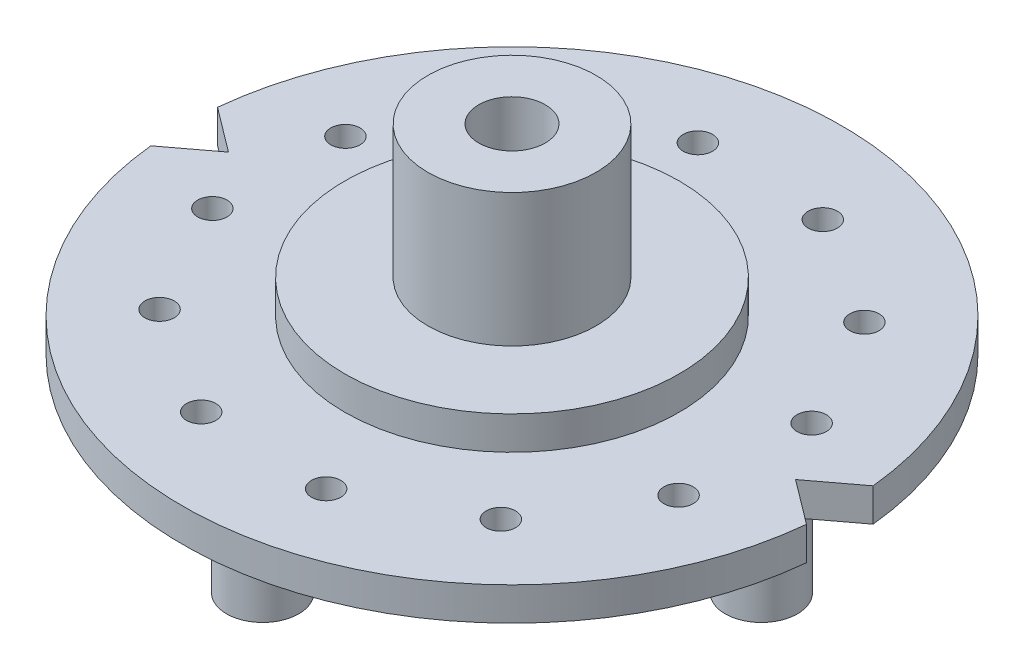
from build123d import *

# Parameters (mm, degrees)
SKETCH2_R           = 1.905
CUT_EXTRUDE1_DEPTH  = 4.318
CUT_EXTRUDE2_DEPTH  = 66.838691254
SKETCH4_R           = 4.699
BOSS_EXTRUDE1_DEPTH = 10.668


with BuildPart() as part:
    # Sketch1 → Revolve1 (revolve)
    with BuildSketch(Plane.XY, mode=Mode.PRIVATE) as revolve1_sk:
        Polygon((-42.799, 0), (0, 0), (0, 4.572), (-4.318, 4.572), (-4.318, 25.908), (-10.922, 25.908), (-10.922, 8.636), (-21.717, 8.636), (-21.717, 4.318), (-42.799, 4.318), align=None)
    revolve(revolve1_sk.sketch.rotate(Axis((0, 25.908, 0), (0, -1, 0)), 270), axis=Axis((0, 25.908, 0), (0, -1, 0)))

    # Sketch2 → Cut-Extrude1 (cut)
    with BuildSketch(Plane(origin=(0, 4.318, 0), x_dir=(1, 0, 0), z_dir=(0, 1, 0))):
        with Locations(Location((-31.001055742, 9.366043342, 0), (0, 0, 270))):
            Circle(SKETCH2_R)
        with Locations(Location((-22.164680145, 23.611759338, 0), (0, 0, 270))):
            Circle(SKETCH2_R)
        with Locations(Location((-7.389296403, 31.530723488, 0), (0, 0, 270))):
            Circle(SKETCH2_R)
        with Locations(Location((9.366043342, 31.001055742, 0), (0, 0, 270))):
            Circle(SKETCH2_R)
        with Locations(Location((23.611759338, 22.164680145, 0), (0, 0, 270))):
            Circle(SKETCH2_R)
        with Locations(Location((31.530723488, 7.389296403, 0), (0, 0, 270))):
            Circle(SKETCH2_R)
        with Locations(Location((31.001055742, -9.366043342, 0), (0, 0, 270))):
            Circle(SKETCH2_R)
        with Locations(Location((22.164680145, -23.611759338, 0), (0, 0, 270))):
            Circle(SKETCH2_R)
        with Locations(Location((7.389296403, -31.530723488, 0), (0, 0, 270))):
            Circle(SKETCH2_R)
        with Locations(Location((-9.366043342, -31.001055742, 0), (0, 0, 270))):
            Circle(SKETCH2_R)
        with Locations(Location((-23.611759338, -22.164680145, 0), (0, 0, 270))):
            Circle(SKETCH2_R)
        with Locations(Location((-31.530723488, -7.389296403, 0), (0, 0, 270))):
            Circle(SKETCH2_R)
    extrude(amount=-CUT_EXTRUDE1_DEPTH, mode=Mode.SUBTRACT)

    # Sketch3 → Cut-Extrude2 (cut, through all)
    with BuildSketch(Plane.XZ):
        with BuildLine():
            ThreePointArc((42.799, 0), (42.744006542, 2.168941149), (42.579167494, 4.33230845))
            Line((42.579167494, 4.33230845), (36.83, 0))
            Line((36.83, 0), (42.579167494, -4.33230845))
            ThreePointArc((42.579167494, -4.33230845), (42.744006542, -2.168941149), (42.799, 0))
        make_face()
        with BuildLine():
            Line((-36.83, 0), (-42.579167494, 4.33230845))
            ThreePointArc((-42.579167494, 4.33230845), (-42.799, 0), (-42.579167494, -4.33230845))
            Line((-42.579167494, -4.33230845), (-36.83, 0))
        make_face()
    extrude(amount=-CUT_EXTRUDE2_DEPTH, mode=Mode.SUBTRACT)

    # Sketch4 → Boss-Extrude1 (add)
    with BuildSketch(Plane.XZ):
        with Locations(Location((0, 32.385, 0), (0, 0, 90))):
            Circle(SKETCH4_R)
        with Locations(Location((32.385, 0, 0), (0, 0, 2.299654478))):
            Circle(SKETCH4_R)
        with Locations(Location((0, -32.385, 0), (0, 0, 90))):
            Circle(SKETCH4_R)
        with Locations(Location((-32.385, 0, 0), (0, 0, 177.700345522))):
            Circle(SKETCH4_R)
    extrude(amount=BOSS_EXTRUDE1_DEPTH)


solid = part.part
